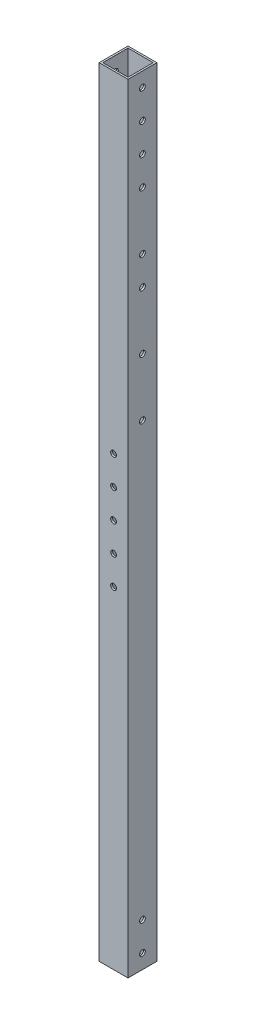
from build123d import *

# Parameters (mm, degrees)
SKETCH1_W                  = 25.4
SKETCH1_H                  = 25.4
SKETCH1_W_2                = 22.225
SKETCH1_H_2                = 22.225
BOSS_EXTRUDE1_DEPTH        = 685.8
F_7_0_201_DIAMETER_HOLE1_D = 5.1054
F_7_0_201_DIAMETER_HOLE2_D = 5.1054


with BuildPart() as part:
    # Sketch1 → Boss-Extrude1 (new body)
    with BuildSketch(Plane(origin=(0, 0, 0), x_dir=(1, 0, 0), z_dir=(0, 1, 0))):
        Rectangle(SKETCH1_W, SKETCH1_H)
        Rectangle(SKETCH1_W_2, SKETCH1_H_2, mode=Mode.SUBTRACT)
    extrude(amount=BOSS_EXTRUDE1_DEPTH)

    # #7 (0.201) Diameter Hole1 (through all)
    with Locations(Plane.XY.offset(12.7)):
        with Locations((0, 292.1), (0, 317.5), (0, 342.9), (0, 368.3), (0, 393.7)):
            Hole(F_7_0_201_DIAMETER_HOLE1_D / 2)

    # #7 (0.201) Diameter Hole2 (through all)
    with Locations(Plane(origin=(12.7, 0, 0), x_dir=(0, 0, -1), z_dir=(1, 0, 0))):
        with Locations((0, 12.7), (0, 38.1), (0, 622.3), (0, 647.7), (0, 673.1), (0, 596.9), (0, 546.1), (0, 520.7), (0, 469.9), (0, 419.1)):
            Hole(F_7_0_201_DIAMETER_HOLE2_D / 2)


solid = part.part
